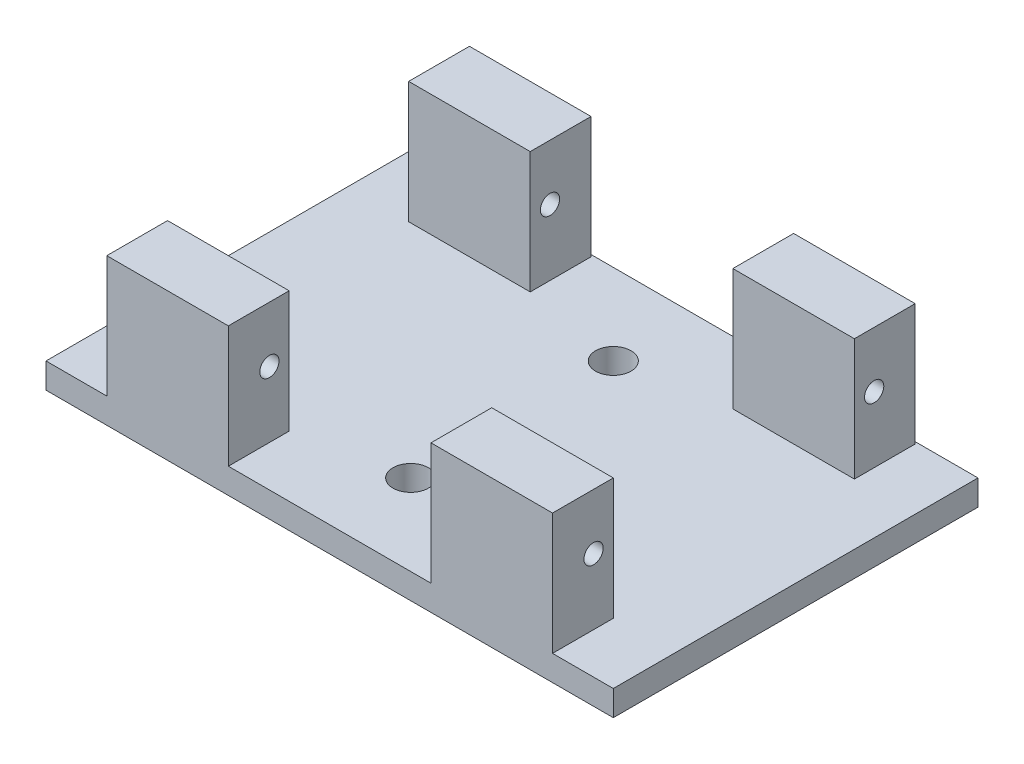
from build123d import *

# Parameters (mm, degrees)
SKETCH_1_W          = 56
SKETCH_1_H          = 36
EXTRUDE_1_DEPTH     = 2.5
SKETCH_2_W          = 12
SKETCH_2_H          = 6
EXTRUDE_2_DEPTH     = 12
SKETCH_3_R          = 0.95
CUT_EXTRUDE_1_DEPTH = 56.084026723
SKETCH_4_R          = 1.75
CUT_EXTRUDE_2_DEPTH = 36.383612026


with BuildPart() as part:
    # 草图1 → 凸台-拉伸1 (new body)
    with BuildSketch(Plane(origin=(0, 0, 0), x_dir=(1, 0, 0), z_dir=(0, 1, 0))):
        Rectangle(SKETCH_1_W, SKETCH_1_H)
    extrude(amount=EXTRUDE_1_DEPTH)

    # 草图2 → 凸台-拉伸2 (add)
    with BuildSketch(Plane(origin=(0, 2.5, 0), x_dir=(1, 0, 0), z_dir=(0, 1, 0))):
        with Locations((16, 14.8)):
            Rectangle(SKETCH_2_W, SKETCH_2_H)
        with Locations((16, -15)):
            Rectangle(SKETCH_2_W, SKETCH_2_H)
    extrude_2 = extrude(amount=EXTRUDE_2_DEPTH)

    # 草图3 → 切除-拉伸1 (cut, through all)
    with BuildSketch(Plane(origin=(22, 0, 0), x_dir=(0, 0, -1), z_dir=(1, 0, 0))):
        with Locations((-13.95, 9)):
            Circle(SKETCH_3_R)
        with Locations((13.75, 9)):
            Circle(SKETCH_3_R)
    cut_extrude_1 = extrude(amount=-CUT_EXTRUDE_1_DEPTH, mode=Mode.SUBTRACT)

    # 镜向1: 凸台-拉伸2, 切除-拉伸1 across plane
    add(extrude_2.mirror(Plane(origin=(0, 0, 0), x_dir=(0, 0, 1), z_dir=(1, 0, 0))))
    add(cut_extrude_1.mirror(Plane(origin=(0, 0, 0), x_dir=(0, 0, 1), z_dir=(1, 0, 0))), mode=Mode.SUBTRACT)

    # 草图4 → 切除-拉伸2 (cut, through all)
    with BuildSketch(Plane(origin=(0, 2.5, 0), x_dir=(1, 0, 0), z_dir=(0, 1, 0))):
        with Locations(Location((0, -10, 0), (0, 0, 270))):
            Circle(SKETCH_4_R)
        with Locations(Location((0, 10, 0), (0, 0, 270))):
            Circle(SKETCH_4_R)
    extrude(amount=-CUT_EXTRUDE_2_DEPTH, mode=Mode.SUBTRACT)


solid = part.part
